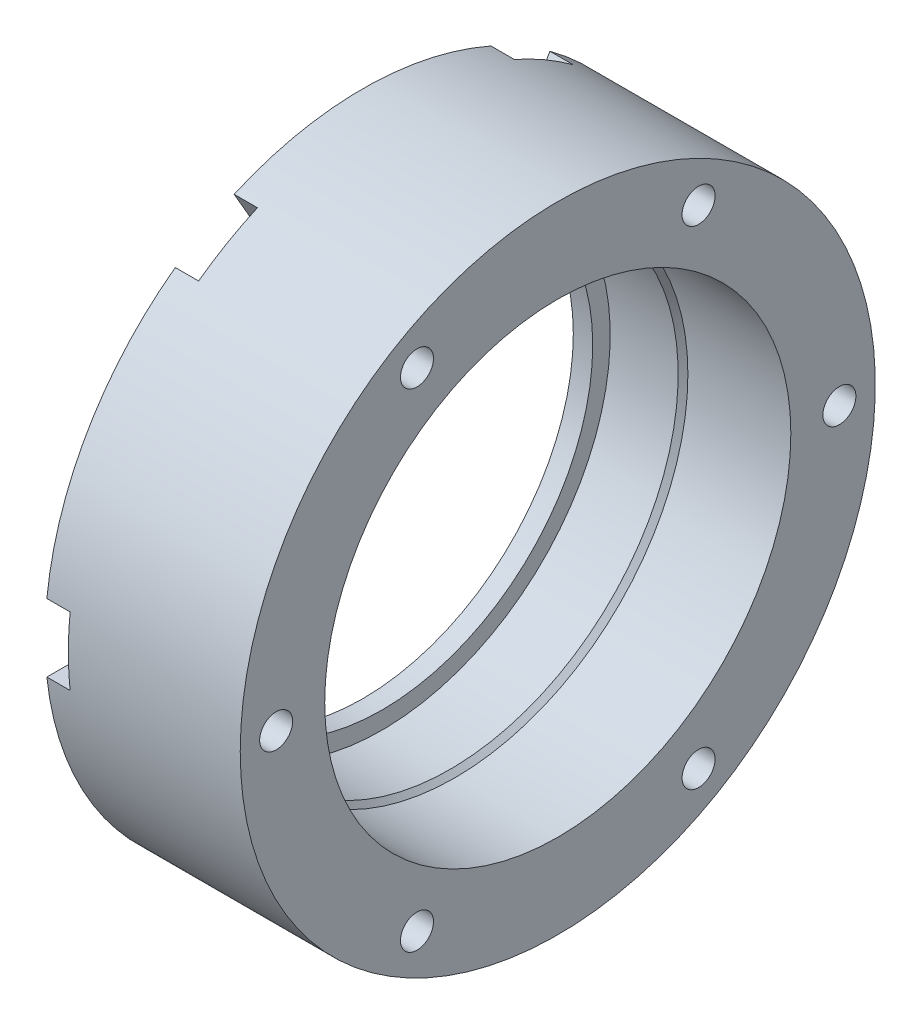
from build123d import *

# Parameters (mm, degrees)
REFRENTADO_PARA_TORNILLO_CON_CABEZA_TRON_D           = 3.4
REFRENTADO_PARA_TORNILLO_CON_CABEZA_TRON_CBORE_D     = 7
REFRENTADO_PARA_TORNILLO_CON_CABEZA_TRON_CBORE_DEPTH = 2.4
CORTAR_EXTRUIR1_DEPTH                                = 2.4


with BuildPart() as part:
    # Croquis2 → Revolución1 (revolve)
    with BuildSketch(Plane(origin=(0, 0, 0), x_dir=(1, 0, 0), z_dir=(0, 1, 0)), mode=Mode.PRIVATE) as revoluci_n1_sk:
        Polygon((0, 32.7), (20.1, 32.7), (20.1, 24), (9.5, 24), (9, 23.5), (2, 23.5), (2, 21.7), (0, 21.7), align=None)
    revolve(revoluci_n1_sk.sketch.rotate(Axis((-10.750662053, 0, 0), (1, 0, 0)), 180), axis=Axis((-10.750662053, 0, 0), (1, 0, 0)))

    # Refrentado para tornillo con cabeza troncocónica de M31 (through all)
    with Locations(Plane.ZY):
        with Locations((14.5, 25.11473671), (29, 0), (14.5, -25.11473671), (-14.5, -25.11473671), (-29, 0), (-14.5, 25.11473671)):
            CounterBoreHole(REFRENTADO_PARA_TORNILLO_CON_CABEZA_TRON_D / 2, REFRENTADO_PARA_TORNILLO_CON_CABEZA_TRON_CBORE_D / 2, REFRENTADO_PARA_TORNILLO_CON_CABEZA_TRON_CBORE_DEPTH)

    # Croquis6 → Cortar-Extruir1 (cut)
    with BuildSketch(Plane.ZY):
        with BuildLine():
            Line((29, 3.5), (32.512151574, 3.5))
            ThreePointArc((32.512151574, 3.5), (32.7, 0), (32.512151574, -3.5))
            Line((32.512151574, -3.5), (29, -3.5))
            ThreePointArc((29, -3.5), (25.5, 0), (29, 3.5))
        make_face()
        with BuildLine():
            Line((17.531088913, -23.36473671), (19.2871647, -26.406349195))
            ThreePointArc((19.2871647, -26.406349195), (16.35, -28.319030704), (13.224986874, -29.906349195))
            Line((13.224986874, -29.906349195), (11.468911087, -26.86473671))
            ThreePointArc((11.468911087, -26.86473671), (12.75, -22.083647797), (17.531088913, -23.36473671))
        make_face()
        with BuildLine():
            Line((-11.468911087, -26.86473671), (-13.224986874, -29.906349195))
            ThreePointArc((-13.224986874, -29.906349195), (-16.35, -28.319030704), (-19.2871647, -26.406349195))
            Line((-19.2871647, -26.406349195), (-17.531088913, -23.36473671))
            ThreePointArc((-17.531088913, -23.36473671), (-12.75, -22.083647797), (-11.468911087, -26.86473671))
        make_face()
        with BuildLine():
            Line((-29, -3.5), (-32.512151574, -3.5))
            ThreePointArc((-32.512151574, -3.5), (-32.7, 0), (-32.512151574, 3.5))
            Line((-32.512151574, 3.5), (-29, 3.5))
            ThreePointArc((-29, 3.5), (-25.5, 0), (-29, -3.5))
        make_face()
        with BuildLine():
            Line((-17.531088913, 23.36473671), (-19.2871647, 26.406349195))
            ThreePointArc((-19.2871647, 26.406349195), (-16.35, 28.319030704), (-13.224986874, 29.906349195))
            Line((-13.224986874, 29.906349195), (-11.468911087, 26.86473671))
            ThreePointArc((-11.468911087, 26.86473671), (-12.75, 22.083647797), (-17.531088913, 23.36473671))
        make_face()
        with BuildLine():
            Line((11.468911087, 26.86473671), (13.224986874, 29.906349195))
            ThreePointArc((13.224986874, 29.906349195), (16.35, 28.319030704), (19.2871647, 26.406349195))
            Line((19.2871647, 26.406349195), (17.531088913, 23.36473671))
            ThreePointArc((17.531088913, 23.36473671), (12.75, 22.083647797), (11.468911087, 26.86473671))
        make_face()
    extrude(amount=-CORTAR_EXTRUIR1_DEPTH, mode=Mode.SUBTRACT)


solid = part.part
